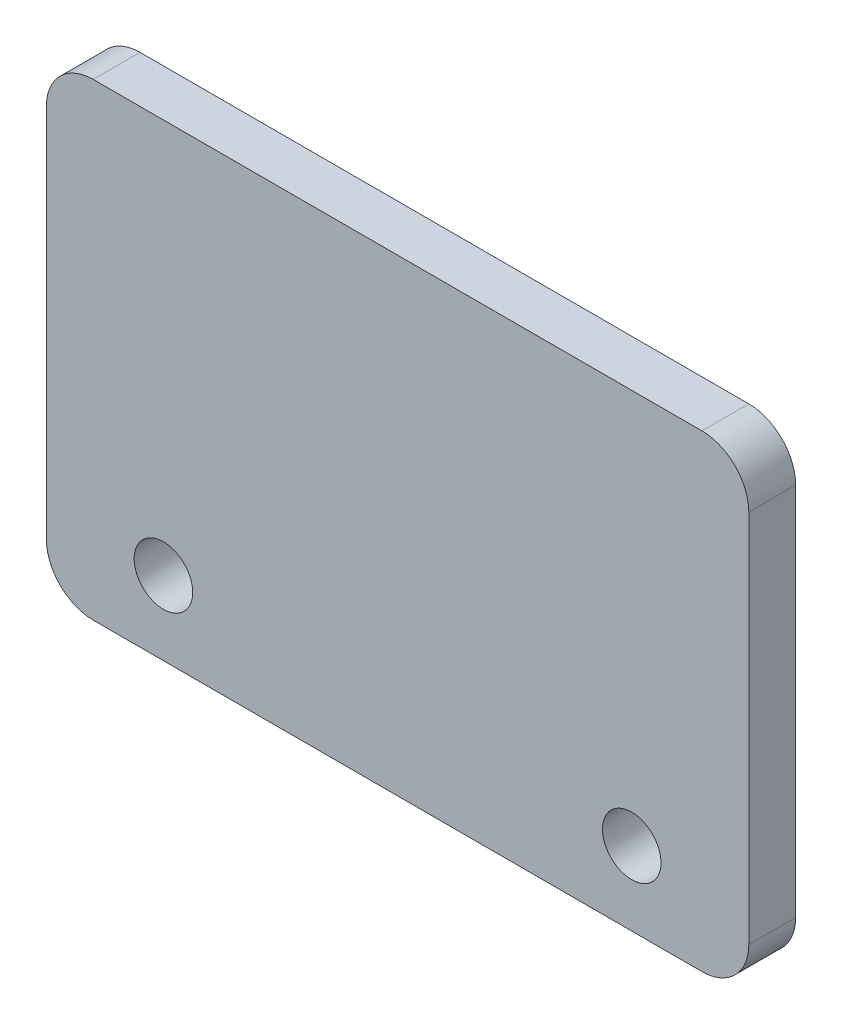
from build123d import *

# Parameters (mm, degrees)
SKETCH_1_W          = 30
SKETCH_1_H          = 20
EXTRUDE_1_DEPTH     = 2
SKETCH_2_R          = 1.25
CUT_EXTRUDE_1_DEPTH = 2
FILLET_1_R          = 2


with BuildPart() as part:
    # 草图1 → 凸台-拉伸1 (new body)
    with BuildSketch(Plane.XY):
        Rectangle(SKETCH_1_W, SKETCH_1_H)
    extrude(amount=EXTRUDE_1_DEPTH)

    # 草图2 → 切除-拉伸1 (cut)
    with BuildSketch(Plane.XY.offset(2)):
        with Locations((-10, -6.85)):
            Circle(SKETCH_2_R)
        with Locations((10, -6.85)):
            Circle(SKETCH_2_R)
    extrude(amount=-CUT_EXTRUDE_1_DEPTH, mode=Mode.SUBTRACT)

    # 圆角1
    fillet_1_edges = [part.edges().sort_by_distance(p)[0] for p in [
        (15, -10, 1),
        (-15, -10, 1),
        (-15, 10, 1),
        (15, 10, 1),
    ]]
    fillet(fillet_1_edges, radius=FILLET_1_R)


solid = part.part
